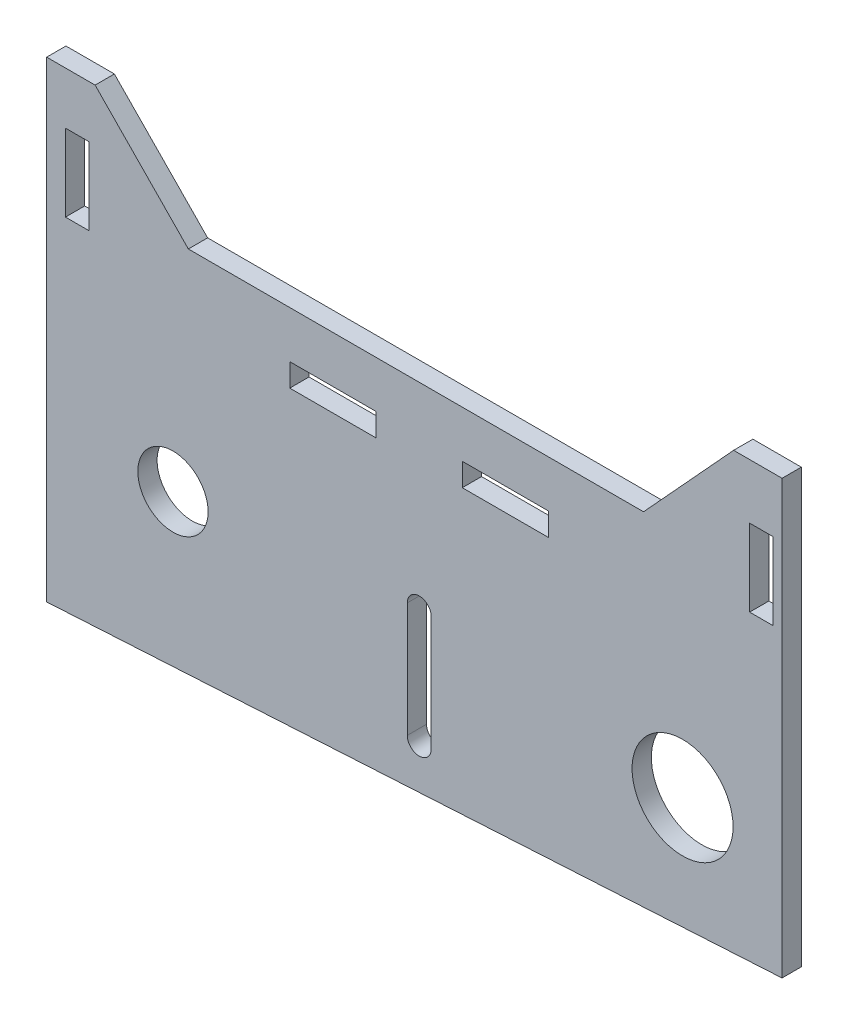
from build123d import *

# Parameters (mm, degrees)
SKETCH2_R           = 9.7
SKETCH2_R_2         = 6.75
SKETCH2_W           = 4.5
SKETCH2_H           = 14.8
SKETCH2_W_2         = 16.6
SKETCH2_H_2         = 4.4
BOSS_EXTRUDE1_DEPTH = 3.7


with BuildPart() as part:
    # Sketch2 → Boss-Extrude1 (new body)
    with BuildSketch(Plane.XY):
        Polygon((-66.408376963, -37.473298429), (-66.408376963, 53.126701571), (-57.108376963, 53.126701571), (-39.206701064, 34.826701571), (48.193298936, 34.826701571), (65.490462758, 53.699118578), (74.790462758, 53.699118578), (74.790462758, -29.400881422), align=None)
        with Locations((55.690462758, -8.957731732)):
            Circle(SKETCH2_R, mode=Mode.SUBTRACT)
        with Locations((-42.158376963, -6.98947646)):
            Circle(SKETCH2_R_2, mode=Mode.SUBTRACT)
        with Locations((-60.558376963, 35.726701571)):
            Rectangle(SKETCH2_W, SKETCH2_H, mode=Mode.SUBTRACT)
        with Locations((70.815419874, 35.726701571)):
            Rectangle(SKETCH2_W, SKETCH2_H, mode=Mode.SUBTRACT)
        with Locations((-11.433419848, 23.626701571)):
            Rectangle(SKETCH2_W_2, SKETCH2_H_2, mode=Mode.SUBTRACT)
        with Locations((21.690462758, 23.626701571)):
            Rectangle(SKETCH2_W_2, SKETCH2_H_2, mode=Mode.SUBTRACT)
        with BuildLine():
            Line((7.428521455, -3.001867406), (7.428521455, -25.037089926))
            ThreePointArc((7.428521455, -25.037089926), (5.128521455, -27.337089926), (2.828521455, -25.037089926))
            Line((2.828521455, -25.037089926), (2.828521455, -3.001867406))
            ThreePointArc((2.828521455, -3.001867406), (5.128521455, -0.701867406), (7.428521455, -3.001867406))
        make_face(mode=Mode.SUBTRACT)
    extrude(amount=BOSS_EXTRUDE1_DEPTH)


solid = part.part
